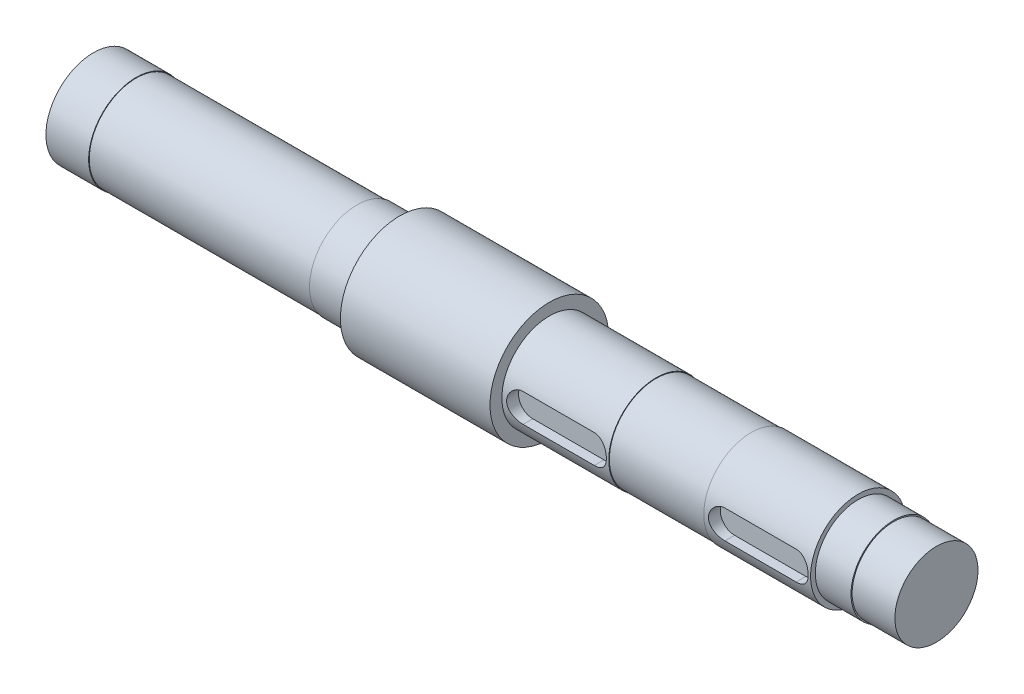
from build123d import *

# Parameters (mm, degrees)
CUT_EXTRUDE_1_DEPTH = 10


with BuildPart() as part:
    # 草图1 → 旋转1 (revolve)
    with BuildSketch(Plane.XY, mode=Mode.PRIVATE) as revolve_1_sk:
        Polygon((0, 0), (0, 20), (18, 20), (18, 19.75), (111, 19.75), (111, 20), (129, 20), (129, 25), (192, 25), (192, 20), (237, 20), (237, 19.75), (277, 19.75), (277, 20), (322, 20), (322, 18), (337, 18), (337, 17.5), (355, 17.5), (355, 0), align=None)
    revolve(revolve_1_sk.sketch.rotate(Axis((0, 0, 0), (-1, 0, 0)), 90), axis=Axis((0, 0, 0), (-1, 0, 0)))

    # 草图2 → 切除-拉伸1 (cut)
    with BuildSketch(Plane.XY.offset(15)):
        with BuildLine():
            Line((200, 6), (230, 6))
            ThreePointArc((230, 6), (236, 0), (230, -6))
            Line((230, -6), (200, -6))
            ThreePointArc((200, -6), (194, 0), (200, 6))
        make_face()
        with BuildLine():
            Line((285, 6), (315, 6))
            ThreePointArc((315, 6), (321, 0), (315, -6))
            Line((315, -6), (285, -6))
            ThreePointArc((285, -6), (279, 0), (285, 6))
        make_face()
    extrude(amount=CUT_EXTRUDE_1_DEPTH, mode=Mode.SUBTRACT)


solid = part.part
